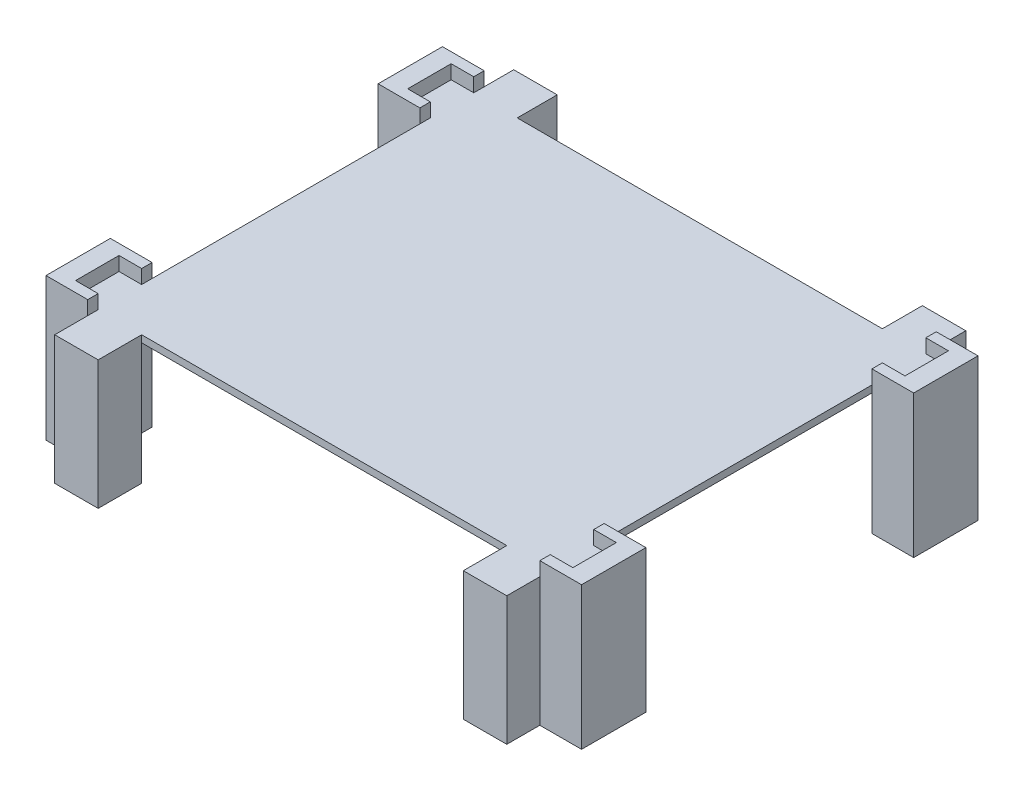
from build123d import *

# Parameters (mm, degrees)
SKETCH9_W           = 5.5
SKETCH9_H           = 12.5
BOSS_EXTRUDE1_DEPTH = 4
SKETCH11_W          = 6.5
SKETCH11_H          = 12.5
SKETCH11_W_2        = 12
SKETCH11_H_2        = 18.5
BOSS_EXTRUDE2_DEPTH = 2
BOSS_EXTRUDE3_DEPTH = 2
BOSS_EXTRUDE4_DEPTH = 35


with BuildPart() as part:
    # Sketch9 → Boss-Extrude1 (new body)
    with BuildSketch(Plane(origin=(0, 3, 0), x_dir=(1, 0, 0), z_dir=(0, 1, 0))):
        Polygon((0, -3), (0, 0), (-6.5, 0), (-12, 0), (-12, -3), align=None)
        with Locations((-9.25, 6.25)):
            Rectangle(SKETCH9_W, SKETCH9_H)
        Polygon((-6.5, 12.5), (0, 12.5), (0, 15.5), (-12, 15.5), (-12, 12.5), align=None)
        Polygon((130, 15.5), (130, 12.5), (136.5, 12.5), (142, 12.5), (142, 15.5), align=None)
        with Locations((139.25, 6.25)):
            Rectangle(SKETCH9_W, SKETCH9_H)
        Polygon((136.5, 0), (130, 0), (130, -3), (142, -3), (142, 0), align=None)
        Polygon((136.5, 95.5), (130, 95.5), (130, 92.5), (142, 92.5), (142, 95.5), align=None)
        with Locations((139.25, 101.75)):
            Rectangle(SKETCH9_W, SKETCH9_H)
        Polygon((130, 111), (130, 108), (136.5, 108), (142, 108), (142, 111), align=None)
        Polygon((0, 92.5), (0, 95.5), (-6.5, 95.5), (-12, 95.5), (-12, 92.5), align=None)
        with Locations((-9.25, 101.75)):
            Rectangle(SKETCH9_W, SKETCH9_H)
        Polygon((-6.5, 108), (0, 108), (0, 111), (-12, 111), (-12, 108), align=None)
    extrude(amount=BOSS_EXTRUDE1_DEPTH)

    # Sketch11 → Boss-Extrude2 (add)
    with BuildSketch(Plane.XZ.offset(-3)):
        Polygon((130, 0), (0, 0), (0, -12.5), (0, -15.5), (0, -92.5), (0, -108), (130, -108), (130, -92.5), (130, -15.5), align=None)
        with Locations((-3.25, -6.25)):
            Rectangle(SKETCH11_W, SKETCH11_H)
        Polygon((-6.5, -12.5), (-6.5, 0), (0, 0), (0, 3), (-12, 3), (-12, -15.5), (0, -15.5), (0, -12.5), align=None)
        with Locations((136, -6.25)):
            Rectangle(SKETCH11_W_2, SKETCH11_H_2)
        with Locations((136, -101.75)):
            Rectangle(SKETCH11_W_2, SKETCH11_H_2)
        with Locations((-6, -101.75)):
            Rectangle(SKETCH11_W_2, SKETCH11_H_2)
    extrude(amount=BOSS_EXTRUDE2_DEPTH)

    # Sketch12 → Boss-Extrude3 (add)
    with BuildSketch(Plane.XZ.offset(-1)):
        Polygon((12.5, -119.5), (12.5, -108), (0, -108), (0, -111), (0, -119.5), align=None)
        Polygon((0, 0), (12.5, 0), (12.5, 12.5), (0, 12.5), (0, 3), align=None)
        Polygon((117.5, 0), (130, 0), (130, 3), (130, 12.5), (117.5, 12.5), align=None)
        Polygon((130, -111), (130, -108), (117.5, -108), (117.5, -119.5), (130, -119.5), align=None)
    extrude(amount=-BOSS_EXTRUDE3_DEPTH)

    # Sketch13 → Boss-Extrude4 (add)
    with BuildSketch(Plane(origin=(0, 1, 0), x_dir=(-1, 0, 0), z_dir=(0, -1, 0))):
        Polygon((-12.5, -12.5), (0, -12.5), (0, -3), (0, 0), (-12.5, 0), align=None)
        Polygon((0, 0), (0, -3), (12, -3), (12, 15.5), (0, 15.5), align=None)
        Polygon((-117.5, -12.5), (-117.5, 0), (-130, 0), (-130, -3), (-130, -12.5), align=None)
        Polygon((-130, -3), (-130, 0), (-130, 15.5), (-142, 15.5), (-142, -3), align=None)
        Polygon((-142, 92.5), (-130, 92.5), (-130, 108), (-130, 111), (-142, 111), align=None)
        Polygon((-130, 111), (-130, 108), (-117.5, 108), (-117.5, 119.5), (-130, 119.5), align=None)
        Polygon((-12.5, 108), (0, 108), (0, 111), (0, 119.5), (-12.5, 119.5), align=None)
        Polygon((0, 108), (0, 92.5), (12, 92.5), (12, 111), (0, 111), align=None)
    extrude(amount=BOSS_EXTRUDE4_DEPTH)


solid = part.part
